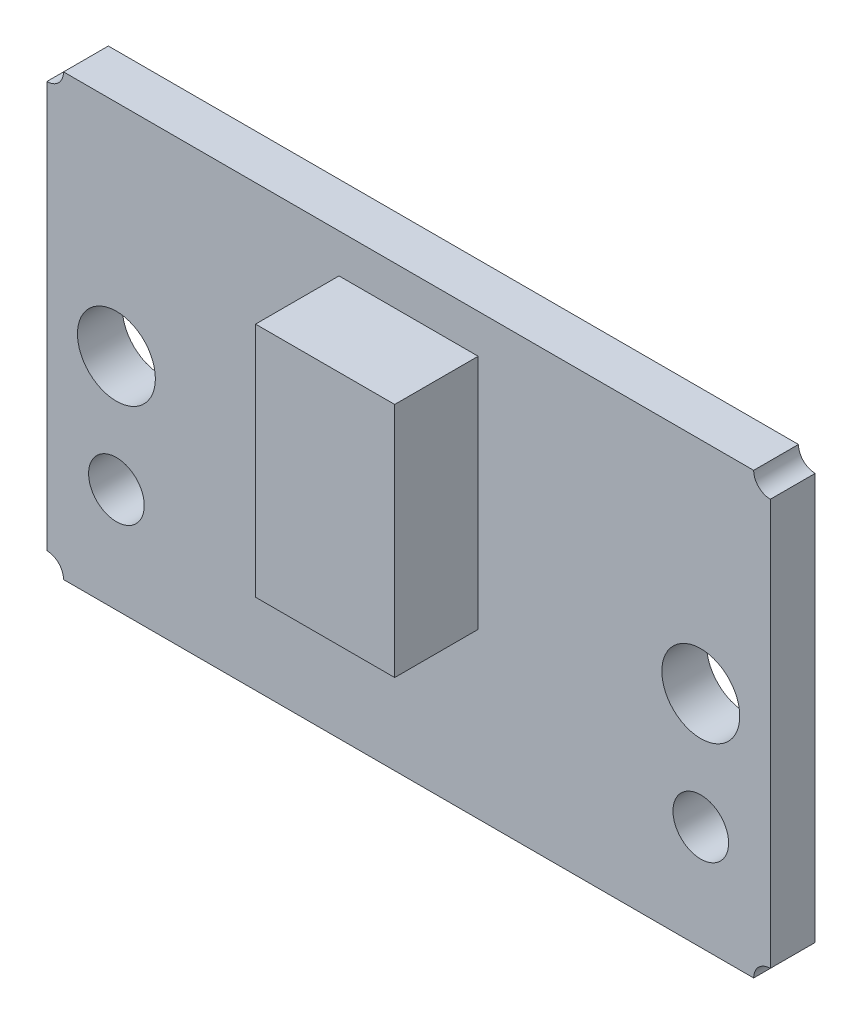
from build123d import *

# Parameters (mm, degrees)
SKETCH1_W           = 26
SKETCH1_H           = 15.8
BOSS_EXTRUDE1_DEPTH = 1.61
SKETCH2_R           = 0.6
CUT_EXTRUDE1_DEPTH  = 1.61
SKETCH3_R           = 1.4
SKETCH3_R_2         = 1
CUT_EXTRUDE2_DEPTH  = 11.61
SKETCH4_W           = 5
SKETCH4_H           = 8.5
BOSS_EXTRUDE2_DEPTH = 3


with BuildPart() as part:
    # Sketch1 → Boss-Extrude1 (new body)
    with BuildSketch(Plane.XY):
        Rectangle(SKETCH1_W, SKETCH1_H)
    extrude(amount=BOSS_EXTRUDE1_DEPTH)

    # Sketch2 → Cut-Extrude1 (cut)
    with BuildSketch(Plane.XY.offset(1.61)):
        with Locations((-13, 7.9)):
            Circle(SKETCH2_R)
        with Locations((-13, -7.9)):
            Circle(SKETCH2_R)
        with Locations((13, -7.9)):
            Circle(SKETCH2_R)
        with Locations((13, 7.9)):
            Circle(SKETCH2_R)
    extrude(amount=-CUT_EXTRUDE1_DEPTH, mode=Mode.SUBTRACT)

    # Sketch3 → Cut-Extrude2 (cut)
    with BuildSketch(Plane.XY.offset(1.61)):
        with Locations((-10.5, 0)):
            Circle(SKETCH3_R)
        with Locations((10.5, 0)):
            Circle(SKETCH3_R)
        with Locations((-10.5, -4.15)):
            Circle(SKETCH3_R_2)
        with Locations((10.5, -4.15)):
            Circle(SKETCH3_R_2)
    extrude(amount=-CUT_EXTRUDE2_DEPTH, mode=Mode.SUBTRACT)

    # Sketch4 → Boss-Extrude2 (add)
    with BuildSketch(Plane.XY.offset(1.61)):
        with Locations((0, 2.25)):
            Rectangle(SKETCH4_W, SKETCH4_H)
    extrude(amount=BOSS_EXTRUDE2_DEPTH)


solid = part.part
